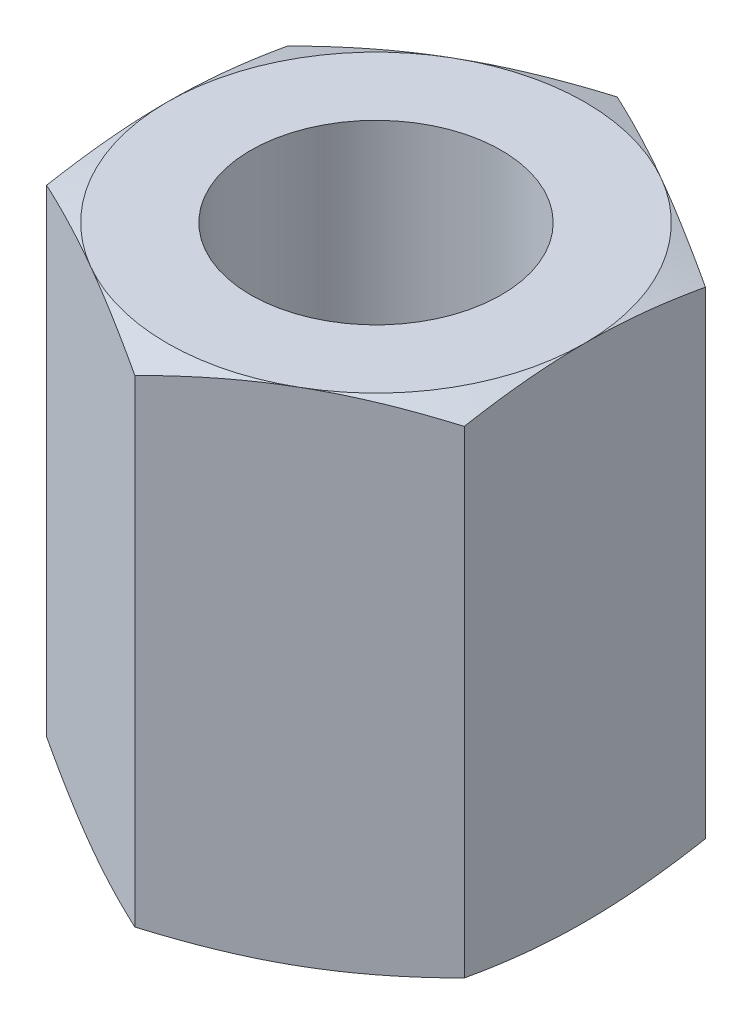
from build123d import *

# Parameters (mm, degrees)
SKETCH1_R           = 1.5
BOSS_EXTRUDE1_DEPTH = 6


with BuildPart() as part:
    # Sketch1 → Boss-Extrude1 (new body)
    with BuildSketch(Plane(origin=(0, 0, 0), x_dir=(1, 0, 0), z_dir=(0, 1, 0))):
        Polygon((0, 2.886751346), (-2.5, 1.443375673), (-2.5, -1.443375673), (0, -2.886751346), (2.5, -1.443375673), (2.5, 1.443375673), align=None)
        with Locations(Location((0, 0, 0), (0, 0, 270))):
            Circle(SKETCH1_R, mode=Mode.SUBTRACT)
    extrude(amount=BOSS_EXTRUDE1_DEPTH)

    # Sketch6 → Cut-Revolve1 (revolve, cut)
    with BuildSketch(Plane.ZY):
        Polygon((2.5, 6), (2.886751346, 6), (2.886751346, 5.859234022), align=None)
    cut_revolve1 = revolve(axis=Axis((0, 6, 0), (0, 1, 0)), mode=Mode.SUBTRACT)

    # Mirror1: Cut-Revolve1 across plane
    add(cut_revolve1.mirror(Plane.ZX.offset(3)), mode=Mode.SUBTRACT)


solid = part.part
